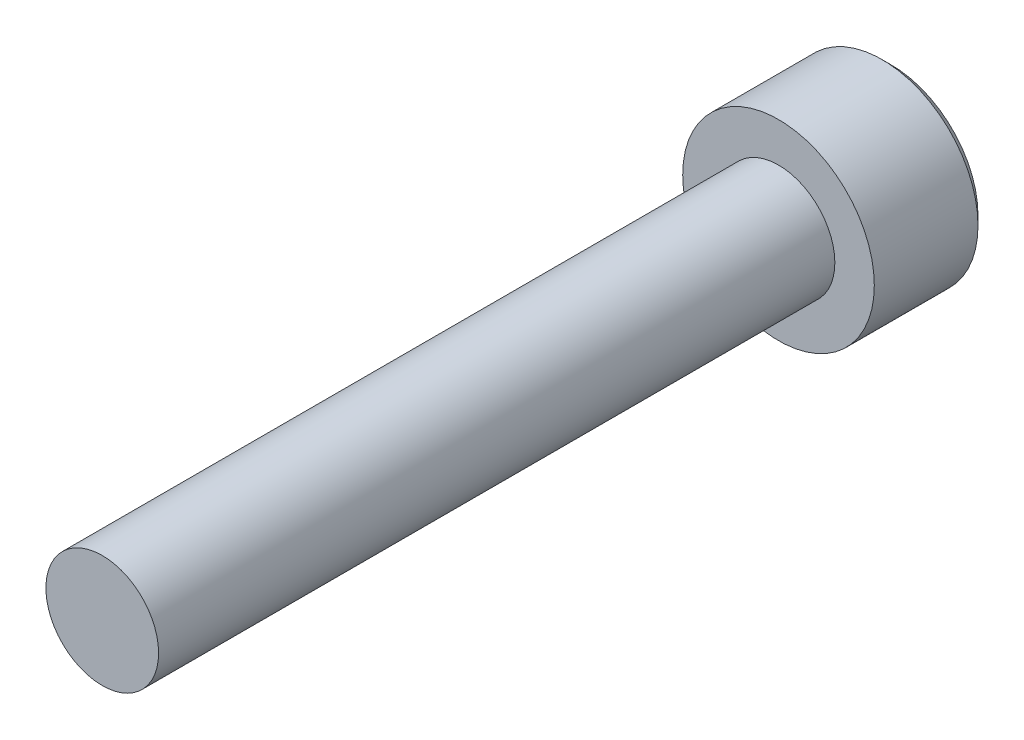
from build123d import *

# Parameters (mm, degrees)
SK_SHANK_R        = 2.5
EXT_SHANK_DEPTH   = 35
SK_HEAD_R         = 4.25
EXT_HEAD_DEPTH    = 5
CUT_HEX_DEPTH     = 3
CHAMFER_HEAD_SIZE = 0.4


with BuildPart() as part:
    # Sk_shank → Ext_shank (new body)
    with BuildSketch(Plane.XY):
        Circle(SK_SHANK_R)
    extrude(amount=EXT_SHANK_DEPTH)

    # Sk_head → Ext_head (add)
    with BuildSketch(Plane.XY):
        Circle(SK_HEAD_R)
    extrude(amount=EXT_HEAD_DEPTH)

    # Sk_hex → Cut_hex (cut)
    with BuildSketch(Plane.XY):
        Polygon((2.309401077, 0), (1.154700538, 2), (-1.154700538, 2), (-2.309401077, 0), (-1.154700538, -2), (1.154700538, -2), align=None)
    extrude(amount=CUT_HEX_DEPTH, mode=Mode.SUBTRACT)

    # Chamfer_head
    chamfer_head_edges = [part.edges().sort_by_distance(p)[0] for p in [
        (1.732050808, -1, 0),
        (1.732050808, 1, 0),
        (0, 2, 0),
        (-1.732050808, 1, 0),
        (-1.732050808, -1, 0),
        (0, -2, 0),
        (-4.25, 0, 0),
    ]]
    chamfer(chamfer_head_edges, length=CHAMFER_HEAD_SIZE)


solid = part.part
